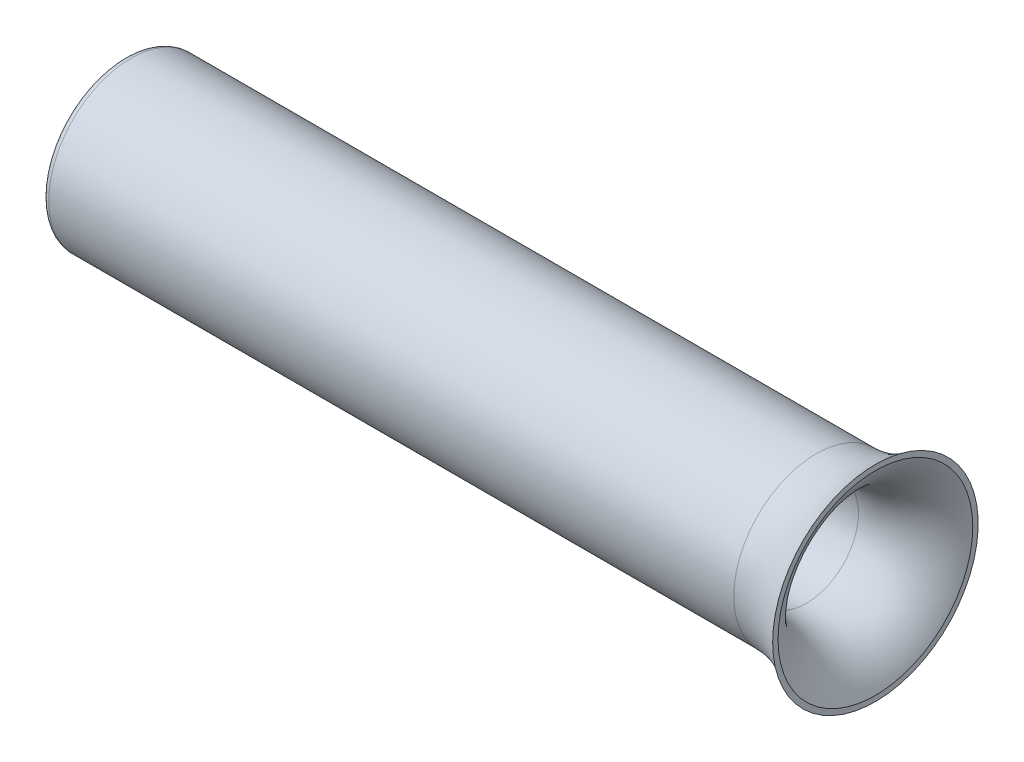
from build123d import *

# Parameters (mm, degrees)
FILLET1_R = 0.5


with BuildPart() as part:
    # Sketch1 → Revolve1 (revolve)
    with BuildSketch(Plane.XY, mode=Mode.PRIVATE) as revolve1_sk:
        with BuildLine():
            Line((0, 6.25), (0, 3.95))
            Line((0, 3.95), (51.764799444, 3.95))
            ThreePointArc((51.764799444, 3.95), (54.897363756, 4.887450418), (57, 7.391585654))
            Line((57, 7.391585654), (57, 7.8))
            ThreePointArc((57, 7.8), (54.879732128, 6.648358339), (52.5, 6.25))
            Line((52.5, 6.25), (0, 6.25))
        make_face()
    revolve(revolve1_sk.sketch.rotate(Axis((0, 0, 0), (1, 0, 0)), 90), axis=Axis((0, 0, 0), (1, 0, 0)))

    # Fillet1
    fillet1_edges = [part.edges().sort_by_distance(p)[0] for p in [
        (0, 0, -3.95),
        (0, 0, -6.25),
    ]]
    fillet(fillet1_edges, radius=FILLET1_R)


solid = part.part
